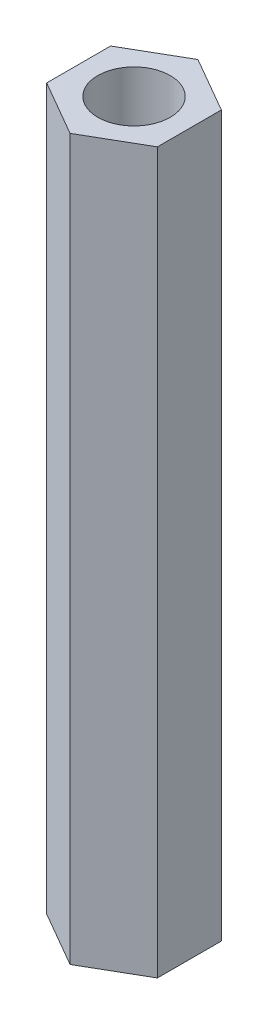
from build123d import *

# Parameters (mm, degrees)
SKETCH1_R           = 1.635
BOSS_EXTRUDE1_DEPTH = 32.5


with BuildPart() as part:
    # Sketch1 → Boss-Extrude1 (new body)
    with BuildSketch(Plane(origin=(0, 0, 0), x_dir=(1, 0, 0), z_dir=(0, 1, 0))):
        Polygon((2.500215268, 1.443500126), (2.500215413, -1.443499874), (1.45e-07, -2.887), (-2.500215268, -1.443500126), (-2.500215413, 1.443499874), (-1.45e-07, 2.887), align=None)
        with Locations(Location((0, 0, 0), (0, 0, 270))):
            Circle(SKETCH1_R, mode=Mode.SUBTRACT)
    extrude(amount=BOSS_EXTRUDE1_DEPTH)


solid = part.part
